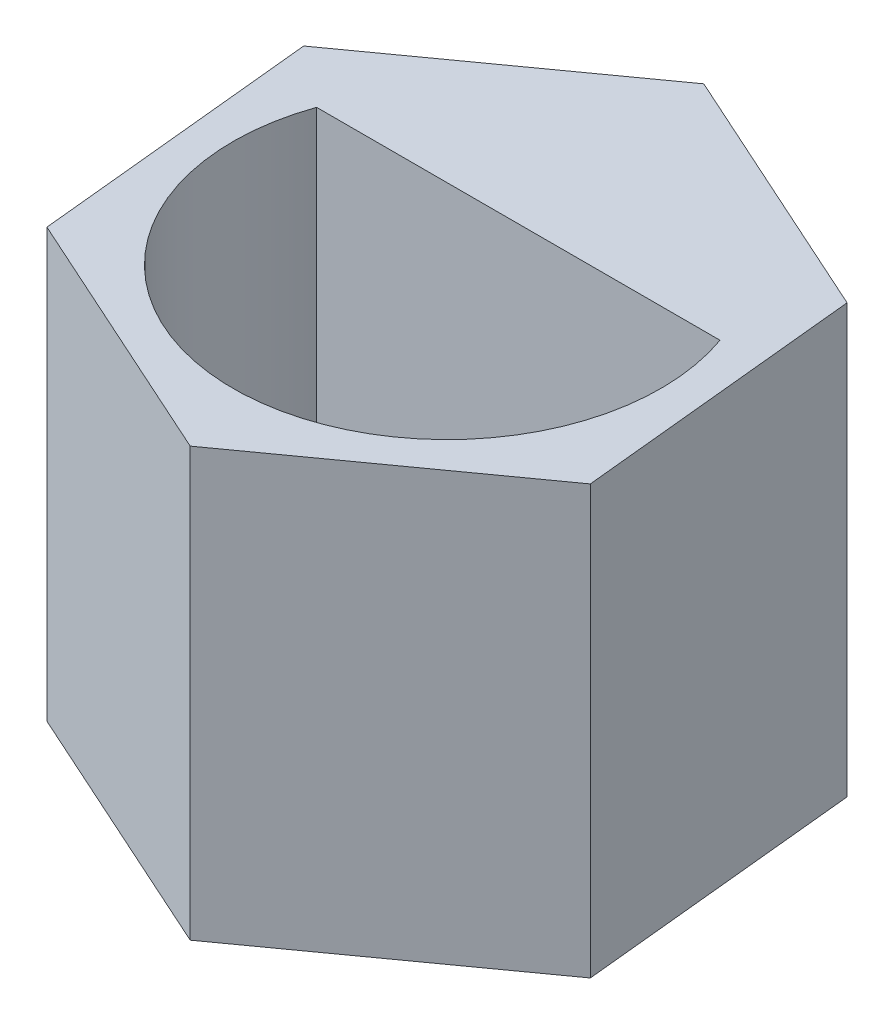
from build123d import *

# Parameters (mm, degrees)
BOSS_EXTRUDE1_DEPTH = 3


with BuildPart() as part:
    # Sketch1 → Boss-Extrude1 (new body)
    with BuildSketch(Plane(origin=(0, 0, 0), x_dir=(1, 0, 0), z_dir=(0, 1, 0))):
        Polygon((1.83187038, -0.827107429), (1.632231235, 1.172892571), (-0.199639144, 2), (-1.83187038, 0.827107429), (-1.632231235, -1.172892571), (0.199639144, -2), align=None)
        with BuildLine():
            Line((-1.414213562, 0.5), (1.414213562, 0.5))
            ThreePointArc((1.414213562, 0.5), (0, -1.5), (-1.414213562, 0.5))
        make_face(mode=Mode.SUBTRACT)
    extrude(amount=BOSS_EXTRUDE1_DEPTH)


solid = part.part
